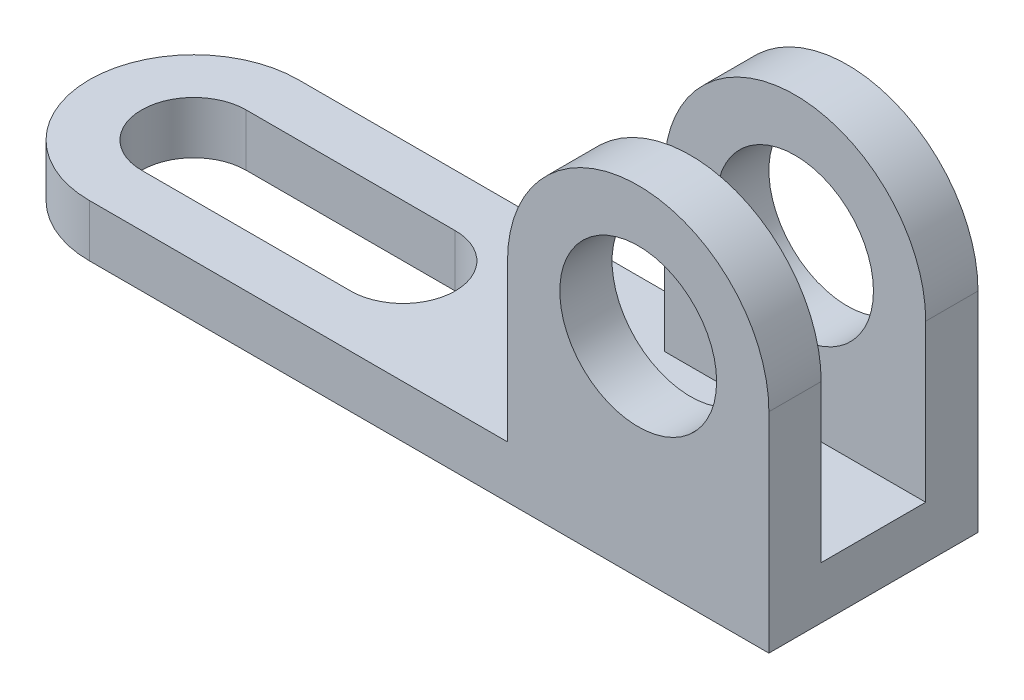
from build123d import *

# Parameters (mm, degrees)
BOSS_EXTRUDE4_DEPTH = 10
SKETCH6_W           = 50
SKETCH6_H           = 40
BOSS_EXTRUDE7_DEPTH = 70
CUT_EXTRUDE2_DEPTH  = 175.642491966
SKETCH10_R          = 15
CUT_EXTRUDE3_DEPTH  = 169.300326797
SKETCH11_W          = 20
SKETCH11_H          = 70
CUT_EXTRUDE4_DEPTH  = 165.69669092
CUT_EXTRUDE5_DEPTH  = 162.012421881


with BuildPart() as part:
    # Sketch5 → Boss-Extrude4 (new body)
    with BuildSketch(Plane(origin=(0, 0, 0), x_dir=(1, 0, 0), z_dir=(0, 1, 0))):
        with BuildLine():
            Line((0, 20), (0, -20))
            Line((0, -20), (-130, -20))
            ThreePointArc((-130, -20), (-150, 0), (-130, 20))
            Line((-130, 20), (0, 20))
        make_face()
    extrude(amount=BOSS_EXTRUDE4_DEPTH)

    # Sketch6 → Boss-Extrude7 (add)
    with BuildSketch(Plane(origin=(0, 10, 0), x_dir=(1, 0, 0), z_dir=(0, 1, 0))):
        with Locations((-25, 0)):
            Rectangle(SKETCH6_W, SKETCH6_H)
    extrude(amount=BOSS_EXTRUDE7_DEPTH)

    # Sketch9 → Cut-Extrude2 (cut, through all)
    with BuildSketch(Plane.XY.offset(20)):
        with BuildLine():
            Line((-50, 40), (-50, 80))
            Line((-50, 80), (0, 80))
            Line((0, 80), (0, 40))
            ThreePointArc((0, 40), (-25, 65), (-50, 40))
        make_face()
    extrude(amount=-CUT_EXTRUDE2_DEPTH, mode=Mode.SUBTRACT)

    # Sketch10 → Cut-Extrude3 (cut, through all)
    with BuildSketch(Plane.XY.offset(20)):
        with Locations((-25, 40)):
            Circle(SKETCH10_R)
    extrude(amount=-CUT_EXTRUDE3_DEPTH, mode=Mode.SUBTRACT)

    # Sketch11 → Cut-Extrude4 (cut, through all)
    with BuildSketch(Plane(origin=(0, 0, 0), x_dir=(0, 0, -1), z_dir=(1, 0, 0))):
        with Locations((0, 45)):
            Rectangle(SKETCH11_W, SKETCH11_H)
    extrude(amount=-CUT_EXTRUDE4_DEPTH, mode=Mode.SUBTRACT)

    # Sketch12 → Cut-Extrude5 (cut, through all)
    with BuildSketch(Plane(origin=(0, 10, 0), x_dir=(1, 0, 0), z_dir=(0, 1, 0))):
        with BuildLine():
            Line((-130, 10), (-90, 10))
            ThreePointArc((-90, 10), (-80, 0), (-90, -10))
            Line((-90, -10), (-130, -10))
            ThreePointArc((-130, -10), (-140, 0), (-130, 10))
        make_face()
    extrude(amount=-CUT_EXTRUDE5_DEPTH, mode=Mode.SUBTRACT)


solid = part.part
